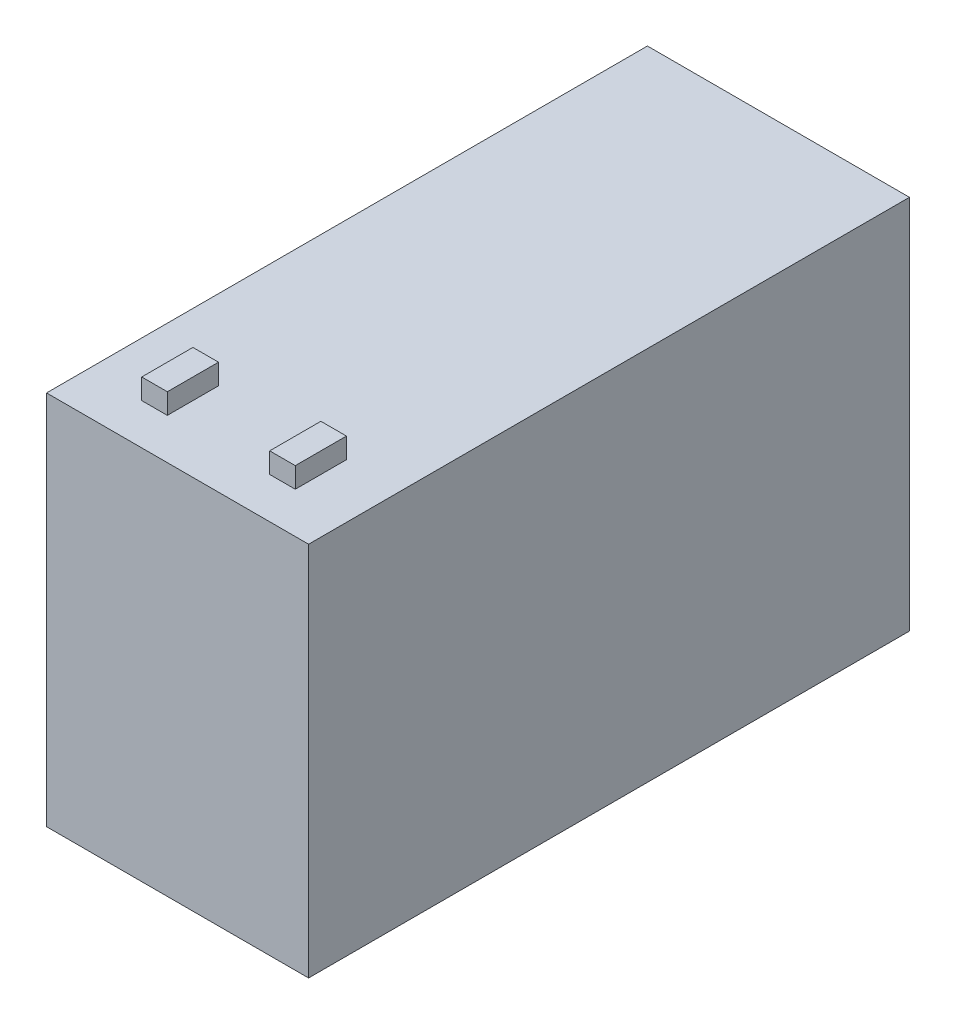
from build123d import *

# Parameters (mm, degrees)
SKETCH1_W           = 65.024
SKETCH1_H           = 93.218
BOSS_EXTRUDE1_DEPTH = 149.098
SKETCH2_W           = 6.35
SKETCH2_H           = 12.7
BOSS_EXTRUDE2_DEPTH = 5.08


with BuildPart() as part:
    # Sketch1 → Boss-Extrude1 (new body)
    with BuildSketch(Plane.XY):
        with Locations((32.512, 46.609)):
            Rectangle(SKETCH1_W, SKETCH1_H)
    extrude(amount=BOSS_EXTRUDE1_DEPTH)

    # Sketch2 → Boss-Extrude2 (add)
    with BuildSketch(Plane(origin=(0, 93.218, 0), x_dir=(1, 0, 0), z_dir=(0, 1, 0))):
        with Locations((16.637, -132.588)):
            Rectangle(SKETCH2_W, SKETCH2_H)
        with Locations((48.387, -132.588)):
            Rectangle(SKETCH2_W, SKETCH2_H)
    extrude(amount=BOSS_EXTRUDE2_DEPTH)


solid = part.part
